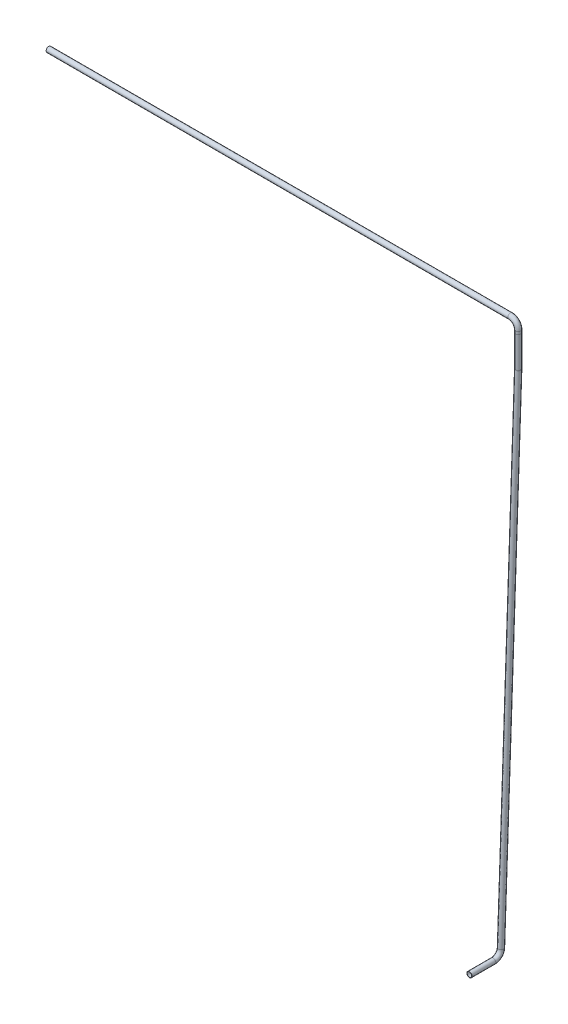
from build123d import *

# Parameters (mm, degrees)
SKETCH1_R   = 12.7
SKETCH1_R_2 = 11.1125


with BuildPart() as part:
    # Sweep1: sweep along a curve in space
    with BuildLine() as sweep1_path:
        Line((0, 0, 0), (0, 0, -115.60725768))
        ThreePointArc((0, 0, -115.60725768), (0, 10.693153607, -142.073741594), (0, 36.770329176, -153.684048189))
        Line((0, 36.770329176, -153.684048189), (0, 2436.028415469, -237.467986772))
        ThreePointArc((0, 2436.028415469, -237.467986772), (0, 2436.914727655, -237.491195673), (0, 2437.801309902, -237.498932759))
        Line((0, 2437.801309902, -237.498932759), (0, 2589.314592603, -237.498932759))
        Line((0, 2589.314592603, -237.498932759), (0, 2602.014592603, -237.498932759))
        ThreePointArc((0, 2602.014592603, -237.498932759), (-11.159231637, 2628.955360967, -237.498932759), (-38.1, 2640.114592603, -237.498932759))
        Line((-38.1, 2640.114592603, -237.498932759), (-2286, 2640.114592603, -237.498932759))
    # Sketch1 → Sweep1 (sweep)
    with BuildSketch(Plane.XY):
        Circle(SKETCH1_R)
        Circle(SKETCH1_R_2, mode=Mode.SUBTRACT)
    sweep(path=sweep1_path.line)


solid = part.part
